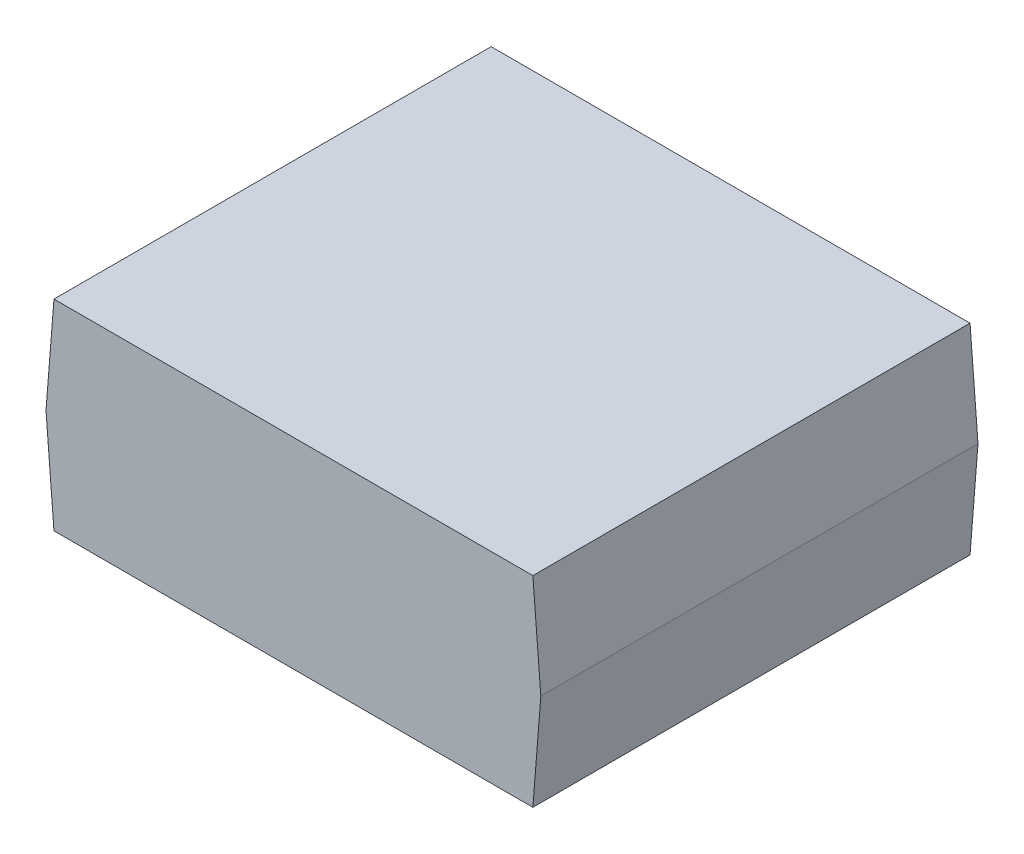
from build123d import *

# Parameters (mm, degrees)
BOSS_EXTRUDE1_DEPTH = 220


with BuildPart() as part:
    # Sketch1 → Boss-Extrude1 (new body)
    with BuildSketch(Plane.XY):
        Polygon((-120.5, 9.110753472), (120.5, 9.110753472), (124.5, -41.389246528), (120.5, -91.889246528), (-120.5, -91.889246528), (-124.5, -41.389246528), align=None)
    extrude(amount=BOSS_EXTRUDE1_DEPTH)


solid = part.part
